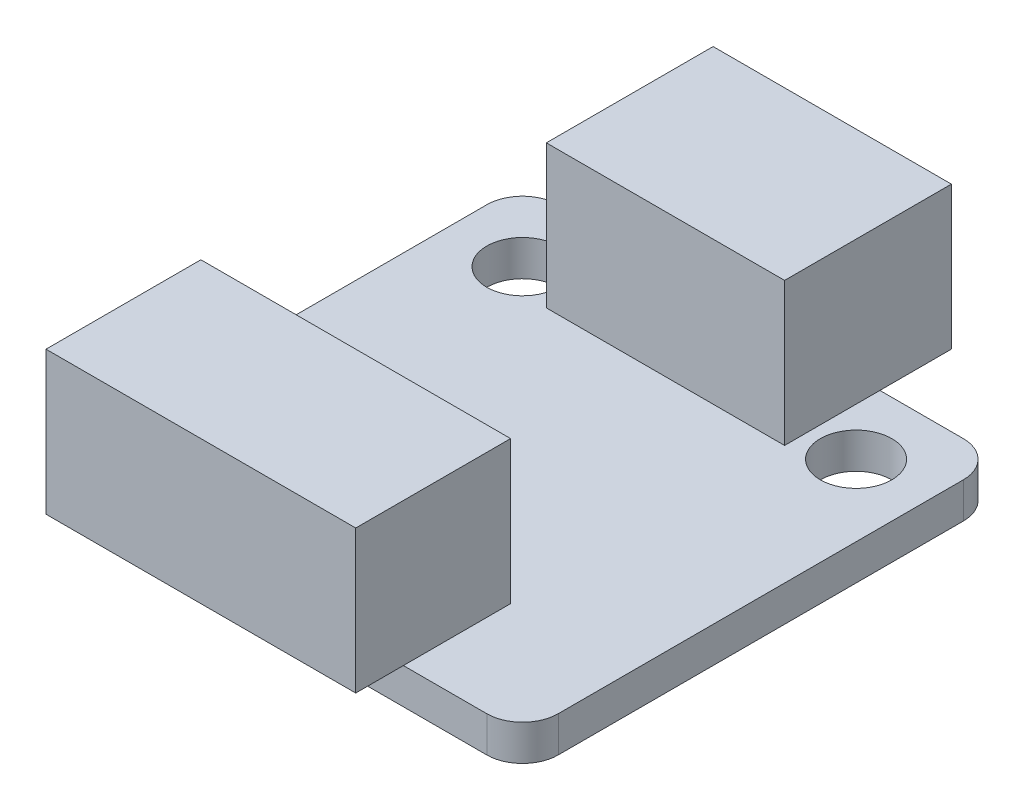
from build123d import *

# Parameters (mm, degrees)
SKETCH1_W           = 20
SKETCH1_H           = 20
BOSS_EXTRUDE1_DEPTH = 1.5
FILLET1_R           = 1.5
SKETCH2_R           = 1.5
CUT_EXTRUDE1_DEPTH  = 1.5
SKETCH3_W           = 10
SKETCH3_H           = 7
BOSS_EXTRUDE2_DEPTH = 6
SKETCH4_W           = 13
SKETCH4_H           = 6.5
BOSS_EXTRUDE3_DEPTH = 6


with BuildPart() as part:
    # Sketch1 → Boss-Extrude1 (new body)
    with BuildSketch(Plane(origin=(0, 0, 0), x_dir=(1, 0, 0), z_dir=(0, 1, 0))):
        Rectangle(SKETCH1_W, SKETCH1_H)
    extrude(amount=BOSS_EXTRUDE1_DEPTH)

    # Fillet1
    fillet1_edges = [part.edges().sort_by_distance(p)[0] for p in [
        (-10, 0.75, -10),
        (10, 0.75, -10),
        (10, 0.75, 10),
        (-10, 0.75, 10),
    ]]
    fillet(fillet1_edges, radius=FILLET1_R)

    # Sketch2 → Cut-Extrude1 (cut)
    with BuildSketch(Plane(origin=(0, 1.5, 0), x_dir=(1, 0, 0), z_dir=(0, 1, 0))):
        with Locations(Location((7, 7, 0), (0, 0, 270))):
            Circle(SKETCH2_R)
        with Locations(Location((-7, 7, 0), (0, 0, 270))):
            Circle(SKETCH2_R)
    extrude(amount=-CUT_EXTRUDE1_DEPTH, mode=Mode.SUBTRACT)

    # Sketch3 → Boss-Extrude2 (add)
    with BuildSketch(Plane(origin=(0, 1.5, 0), x_dir=(1, 0, 0), z_dir=(0, 1, 0))):
        with Locations((0, 9.5)):
            Rectangle(SKETCH3_W, SKETCH3_H)
    extrude(amount=BOSS_EXTRUDE2_DEPTH)

    # Sketch4 → Boss-Extrude3 (add)
    with BuildSketch(Plane(origin=(0, 1.5, 0), x_dir=(1, 0, 0), z_dir=(0, 1, 0))):
        with Locations((-1.5, -8.75)):
            Rectangle(SKETCH4_W, SKETCH4_H)
    extrude(amount=BOSS_EXTRUDE3_DEPTH)


solid = part.part
